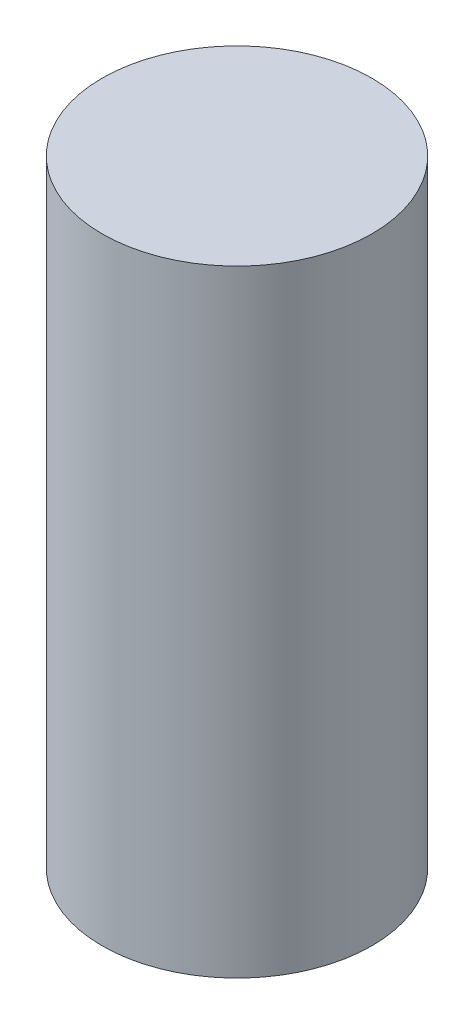
from build123d import *

# Parameters (mm, degrees)
SKETCH_1_R      = 7
EXTRUDE_1_DEPTH = 32


with BuildPart() as part:
    # 草图1 → 凸台-拉伸1 (new body)
    with BuildSketch(Plane(origin=(0, 0, 0), x_dir=(1, 0, 0), z_dir=(0, 1, 0))):
        with Locations(Location((0, 0, 0), (0, 0, 270))):
            Circle(SKETCH_1_R)
    extrude(amount=EXTRUDE_1_DEPTH)


solid = part.part
